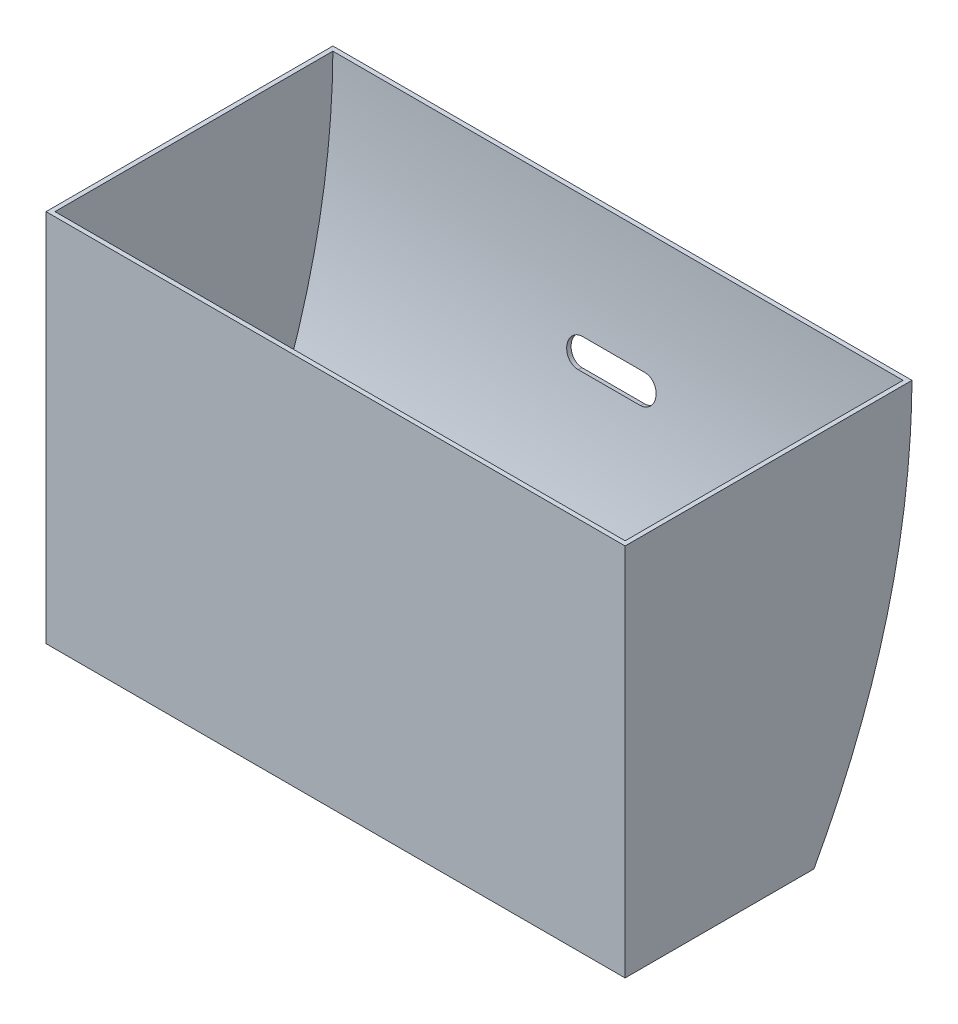
from build123d import *

# Parameters (mm, degrees)
SKETCH1_W            = 65
SKETCH1_H            = 21.2
BOSS_EXTRUDE1_DEPTH  = 42
BOSS_EXTRUDE2_DEPTH  = 65
SHELL3_T             = -0.5
SKETCH3_R            = 0.93
CUT_EXTRUDE1_DEPTH   = 1
LPATTERN1_COUNT      = 13
LPATTERN1_PITCH      = 5
LPATTERN1_COUNT_DIR2 = 5
LPATTERN1_PITCH_DIR2 = 3.275
SKETCH5_R            = 0.93
CUT_EXTRUDE2_DEPTH   = 1
LPATTERN2_COUNT      = 12
LPATTERN2_PITCH      = 5
LPATTERN2_COUNT_DIR2 = 4
LPATTERN2_PITCH_DIR2 = 3.275
CUT_EXTRUDE4_REACH   = 81.498


with BuildPart() as part:
    # Sketch1 → Boss-Extrude1 (new body)
    with BuildSketch(Plane(origin=(0, 0, 0), x_dir=(1, 0, 0), z_dir=(0, 1, 0))):
        with Locations((32.5, 10.6)):
            Rectangle(SKETCH1_W, SKETCH1_H)
    extrude(amount=BOSS_EXTRUDE1_DEPTH)

    # Sketch2 → Boss-Extrude2 (add)
    with BuildSketch(Plane(origin=(65, 0, 0), x_dir=(0, 0, -1), z_dir=(1, 0, 0))):
        with BuildLine():
            Line((21.2, 0), (21.2, 29.2))
            Line((21.2, 29.2), (21.2, 42))
            Line((21.2, 42), (32.2, 42))
            add(Edge.make_bspline(
                [(21.2, 0), (32.077877164, 19.887678502), (32.2, 42)],
                knots=[0, 0, 0, 1, 1, 1], degree=2))
        make_face()
    extrude(amount=-BOSS_EXTRUDE2_DEPTH)

    # Shell3
    shell3_openings = [part.faces().sort_by_distance(p)[0] for p in [
        (32.5, 42, -16.1),
    ]]
    offset(amount=SHELL3_T, openings=shell3_openings, kind=Kind.INTERSECTION)

    # Sketch3 → Cut-Extrude1 (cut)
    with BuildSketch(Plane.XZ):
        with Locations(Location((63, -4.05, 0), (0, 0, 270))):
            Circle(SKETCH3_R)
    cut_extrude1 = extrude(amount=-CUT_EXTRUDE1_DEPTH, mode=Mode.SUBTRACT)

    # LPattern1: Cut-Extrude1 13 × 5
    with Locations(*[(-i * LPATTERN1_PITCH, 0, -j * LPATTERN1_PITCH_DIR2) for i in range(LPATTERN1_COUNT) for j in range(LPATTERN1_COUNT_DIR2) if (i, j) != (0, 0)]):
        add(cut_extrude1, mode=Mode.SUBTRACT)

    # Sketch5 → Cut-Extrude2 (cut)
    with BuildSketch(Plane.XZ):
        with Locations(Location((60.5, -5.6875, 0), (0, 0, 270))):
            Circle(SKETCH5_R)
    cut_extrude2 = extrude(amount=-CUT_EXTRUDE2_DEPTH, mode=Mode.SUBTRACT)

    # LPattern2: Cut-Extrude2 12 × 4
    with Locations(*[(-i * LPATTERN2_PITCH, 0, -j * LPATTERN2_PITCH_DIR2) for i in range(LPATTERN2_COUNT) for j in range(LPATTERN2_COUNT_DIR2) if (i, j) != (0, 0)]):
        add(cut_extrude2, mode=Mode.SUBTRACT)

    # Sketch7 → Cut-Extrude4 (cut, up to next)
    with BuildSketch(Plane(origin=(5, -3.419763894, -25.632099392), x_dir=(1, 0, 0), z_dir=(0, 0.16865835409663912, 0.9856745708363449)), mode=Mode.PRIVATE) as cut_extrude4_sk1:
        with BuildLine():
            Line((24.5, 33.072047017), (31.5, 33.072047017))
            ThreePointArc((31.5, 33.072047017), (33, 31.572047017), (31.5, 30.072047017))
            Line((31.5, 30.072047017), (24.5, 30.072047017))
            ThreePointArc((24.5, 30.072047017), (23, 31.572047017), (24.5, 33.072047017))
        make_face()
    cut_extrude4_tool1 = extrude(cut_extrude4_sk1.sketch, amount=CUT_EXTRUDE4_REACH, mode=Mode.PRIVATE) & part.part
    add(cut_extrude4_tool1.solids().sort_by_distance((33, 27.7, -30.956989))[0], mode=Mode.SUBTRACT)


solid = part.part
